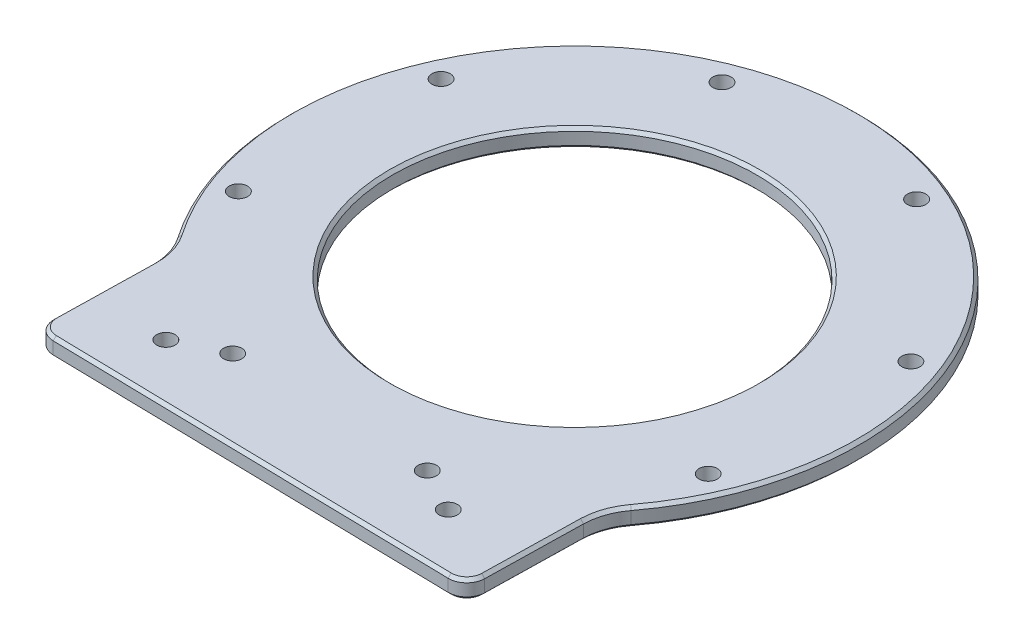
from build123d import *

# Parameters (mm, degrees)
SKETCH_1_R               = 1.5
SKETCH_1_R_2             = 29.8
EXTRUDE_1_DEPTH          = 3
CHAMFER_1_SIZE           = 0.5
CUT_EXTRUDE_1_DEPTH      = 302.180394913
CUT_EXTRUDE_1_DEPTH_BACK = 302.180394913
SKETCH_2_R               = 1.5
CUT_EXTRUDE_2_DEPTH      = 302.180394913
CUT_EXTRUDE_2_DEPTH_BACK = 302.180394913
SKETCH_3_R               = 1.5


with BuildPart() as part:
    # 草图1 → 凸台-拉伸1 (new body)
    with BuildSketch(Plane.XZ.offset(-78.025173071)):
        with BuildLine():
            Line((-212.561517714, -108.249692404), (-212.240178336, -124.096924988))
            ThreePointArc((-212.240178336, -124.096924988), (-212.661273384, -127.177841531), (-214.008389255, -129.980455778))
            ThreePointArc((-214.008389255, -129.980455778), (-174.628775953, -203.200190572), (-138.249712047, -128.44427297))
            ThreePointArc((-138.249712047, -128.44427297), (-139.709332875, -125.698571817), (-140.25497588, -122.637258129))
            Line((-140.25497588, -122.637258129), (-140.576315258, -106.790025545))
            ThreePointArc((-140.576315258, -106.790025545), (-141.497820174, -104.686954783), (-143.636518146, -103.851461562))
            Line((-143.636518146, -103.851461562), (-209.622953731, -105.189489516))
            ThreePointArc((-209.622953731, -105.189489516), (-211.726024493, -106.110994432), (-212.561517714, -108.249692404))
        make_face()
        with Locations((-136.648445194, -139.453062321)):
            Circle(SKETCH_1_R, mode=Mode.SUBTRACT)
        with Locations((-175.575532096, -156.509788424)):
            Circle(SKETCH_1_R_2, mode=Mode.SUBTRACT)
        with Locations((-135.988998284, -171.974468852)):
            Circle(SKETCH_1_R, mode=Mode.SUBTRACT)
        with Locations((-191.040212525, -196.096322235)):
            Circle(SKETCH_1_R, mode=Mode.SUBTRACT)
        with Locations((-215.162065908, -141.045107995)):
            Circle(SKETCH_1_R, mode=Mode.SUBTRACT)
        with Locations((-192.632258198, -117.582701522)):
            Circle(SKETCH_1_R, mode=Mode.SUBTRACT)
        with Locations((-160.110851668, -116.923254612)):
            Circle(SKETCH_1_R, mode=Mode.SUBTRACT)
        with Locations((-214.502618998, -173.566514526)):
            Circle(SKETCH_1_R, mode=Mode.SUBTRACT)
        with Locations((-158.518805994, -195.436875326)):
            Circle(SKETCH_1_R, mode=Mode.SUBTRACT)
    extrude(amount=EXTRUDE_1_DEPTH)

    # 倒角1
    chamfer_1_edges = [part.edges().sort_by_distance(p)[0] for p in [
        (-212.400848023, 78.025173077, -116.173308696),
        (-211.72602449, 78.025173077, -106.110994432),
        (-176.629735936, 78.025173076, -104.520475539),
        (-141.497820172, 78.025173075, -104.686954784),
        (-211.72602449, 75.025173077, -106.110994432),
        (-212.400848023, 75.025173077, -116.173308696),
        (-212.661273381, 75.025173077, -127.177841532),
        (-174.628775951, 75.025173075, -203.200190573),
        (-205.375532094, 78.025173077, -156.509788424),
        (-205.375532094, 75.025173077, -156.509788424),
        (-139.709332873, 75.025173075, -125.698571818),
        (-140.415645567, 75.025173075, -114.713641837),
        (-141.497820172, 75.025173075, -104.686954784),
        (-140.415645566, 78.025173075, -114.713641837),
        (-176.629735936, 75.025173076, -104.520475539),
        (-139.709332873, 78.025173075, -125.698571818),
        (-174.62877595, 78.025173075, -203.200190573),
        (-212.661273381, 78.025173077, -127.177841532),
    ]]
    chamfer(chamfer_1_edges, length=CHAMFER_1_SIZE)

    # 草图2 → 切除-拉伸1 (cut, two sides: drawn at the far end of the back side and taken through both)
    with BuildSketch(Plane(origin=(2e-09, 78.025173071, -1e-09), x_dir=(1.0, -3.1446611841336594e-11, 0), z_dir=(3.1446611841336594e-11, 1.0, -6.574611909583631e-12)).offset(-CUT_EXTRUDE_1_DEPTH_BACK)):
        with Locations(Location((-200.041202679, 114.05266186, 0), (0, 0, 180))):
            Circle(SKETCH_2_R)
    extrude(amount=CUT_EXTRUDE_1_DEPTH + CUT_EXTRUDE_1_DEPTH_BACK, mode=Mode.SUBTRACT)

    # 草图3 → 切除-拉伸2 (cut, two sides: drawn at the far end of the back side and taken through both)
    with BuildSketch(Plane(origin=(2e-09, 78.025173071, -1e-09), x_dir=(1.0, -3.1446611841336594e-11, 0), z_dir=(3.1446611841336594e-11, 1.0, -6.574611909583631e-12)).offset(-CUT_EXTRUDE_2_DEPTH_BACK)):
        with Locations(Location((-152.851097985, 113.09577309, 0), (0, 0, 180))):
            Circle(SKETCH_3_R)
    extrude(amount=CUT_EXTRUDE_2_DEPTH + CUT_EXTRUDE_2_DEPTH_BACK, mode=Mode.SUBTRACT)


solid = part.part
